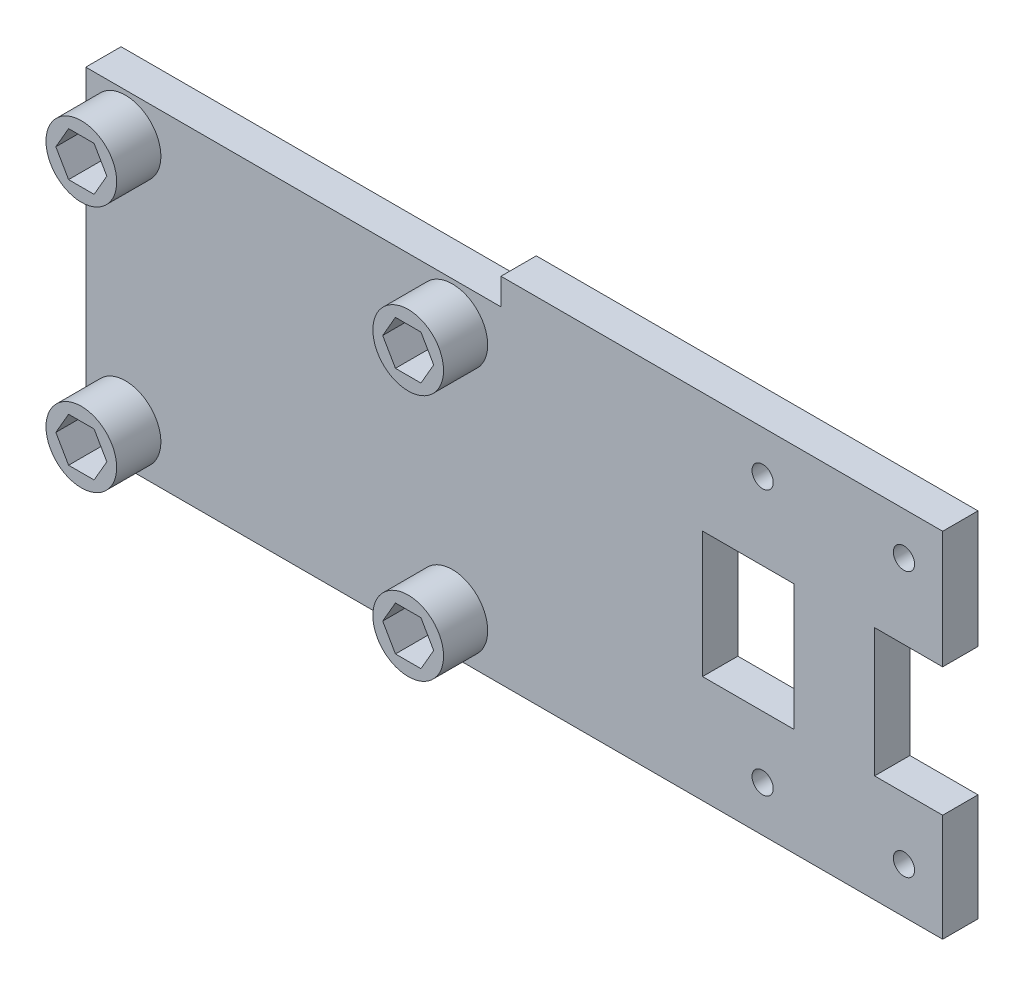
from build123d import *

# Parameters (mm, degrees)
SKETCH1_W                                        = 50
SKETCH1_H                                        = 40
BOSS_EXTRUDE1_DEPTH                              = 4
SKETCH2_W                                        = 7.705962758
SKETCH2_H                                        = 14.539090136
CUT_EXTRUDE1_DEPTH                               = 122.811546491
SKETCH3_W                                        = 10.372123492
SKETCH3_H                                        = 14.267331442
CUT_EXTRUDE2_DEPTH                               = 122.811546491
CBORE_FOR_M2_PAN_HEAD_MACHINE_SCREW1_D           = 2.4
CBORE_FOR_M2_PAN_HEAD_MACHINE_SCREW1_CBORE_D     = 5
CBORE_FOR_M2_PAN_HEAD_MACHINE_SCREW1_CBORE_DEPTH = 1.6
SKETCH6_W                                        = 47
SKETCH6_H                                        = 37
BOSS_EXTRUDE2_DEPTH                              = 4
SKETCH7_R                                        = 4
BOSS_EXTRUDE3_DEPTH                              = 5
F_2_7_2_7_DIAMETER_HOLE1_D                       = 2.7
F_2_7_2_7_DIAMETER_HOLE1_DEPTH                   = 4
F_2_7_2_7_DIAMETER_HOLE1_TIP                     = 0.811161836
CUT_EXTRUDE3_DEPTH                               = 6.5


with BuildPart() as part:
    # Sketch1 → Boss-Extrude1 (new body)
    with BuildSketch(Plane(origin=(0, 0, 34.811611197), x_dir=(-1, 0, 0), z_dir=(0, 0, -1))):
        with Locations((1.46446617, 98.834695645)):
            Rectangle(SKETCH1_W, SKETCH1_H)
    extrude(amount=-BOSS_EXTRUDE1_DEPTH)

    # Sketch2 → Cut-Extrude1 (cut, through all)
    with BuildSketch(Plane.XY.offset(38.811611197)):
        with Locations((19.682552451, 98.267628733)):
            Rectangle(SKETCH2_W, SKETCH2_H)
    extrude(amount=-CUT_EXTRUDE1_DEPTH, mode=Mode.SUBTRACT)

    # Sketch3 → Cut-Extrude2 (cut, through all)
    with BuildSketch(Plane.XY.offset(38.811611197)):
        with Locations((1.539593072, 98.131749386)):
            Rectangle(SKETCH3_W, SKETCH3_H)
    extrude(amount=-CUT_EXTRUDE2_DEPTH, mode=Mode.SUBTRACT)

    # CBORE for M2 Pan Head Machine Screw1 (through all)
    with Locations(Plane(origin=(0, 0, 34.811611197), x_dir=(-1, 0, 0), z_dir=(0, 0, -1))):
        with Locations((-3.156646479, 84.016340669), (-19.156646479, 84.016340669), (-19.156646479, 114.016340669), (-3.156646479, 114.016340669)):
            CounterBoreHole(CBORE_FOR_M2_PAN_HEAD_MACHINE_SCREW1_D / 2, CBORE_FOR_M2_PAN_HEAD_MACHINE_SCREW1_CBORE_D / 2, CBORE_FOR_M2_PAN_HEAD_MACHINE_SCREW1_CBORE_DEPTH)

    # Sketch6 → Boss-Extrude2 (add)
    with BuildSketch(Plane.XY.offset(38.811611197)):
        with Locations((-49.96446617, 97.334695645)):
            Rectangle(SKETCH6_W, SKETCH6_H)
    extrude(amount=-BOSS_EXTRUDE2_DEPTH)

    # Sketch7 → Boss-Extrude3 (add)
    with BuildSketch(Plane.XY.offset(38.811611197)):
        with Locations(Location((-68.96446617, 111.334695645, 0), (0, 0, 180))):
            Circle(SKETCH7_R)
        with Locations(Location((-31.96446617, 111.334695645, 0), (0, 0, 180))):
            Circle(SKETCH7_R)
        with Locations(Location((-68.96446617, 83.334695645, 0), (0, 0, 180))):
            Circle(SKETCH7_R)
        with Locations(Location((-31.96446617, 83.334695645, 0), (0, 0, 180))):
            Circle(SKETCH7_R)
    extrude(amount=BOSS_EXTRUDE3_DEPTH)

    # Ø2.7 (2.7) Diameter Hole1
    with Locations(Plane.XY.offset(43.811611197)):
        with Locations((-68.96446617, 111.334695645), (-31.96446617, 111.334695645), (-31.96446617, 83.334695645), (-68.96446617, 83.334695645)):
            Hole(F_2_7_2_7_DIAMETER_HOLE1_D / 2, depth=F_2_7_2_7_DIAMETER_HOLE1_DEPTH)
            with Locations((0, 0, -(F_2_7_2_7_DIAMETER_HOLE1_DEPTH + F_2_7_2_7_DIAMETER_HOLE1_TIP / 2))):  # 118° drill point
                Cone(0, F_2_7_2_7_DIAMETER_HOLE1_D / 2, F_2_7_2_7_DIAMETER_HOLE1_TIP, mode=Mode.SUBTRACT)

    # Sketch10 → Cut-Extrude3 (cut)
    with BuildSketch(Plane.XY.offset(43.811611197)):
        Polygon((-67.521090497, 113.834695645), (-70.407841843, 113.834695645), (-71.851217516, 111.334695645), (-70.407841843, 108.834695645), (-67.521090497, 108.834695645), (-66.077714824, 111.334695645), align=None)
        Polygon((-67.521090497, 85.834695645), (-70.407841843, 85.834695645), (-71.851217516, 83.334695645), (-70.407841843, 80.834695645), (-67.521090497, 80.834695645), (-66.077714824, 83.334695645), align=None)
        Polygon((-30.521090497, 113.834695645), (-33.407841843, 113.834695645), (-34.851217516, 111.334695645), (-33.407841843, 108.834695645), (-30.521090497, 108.834695645), (-29.077714824, 111.334695645), align=None)
        Polygon((-30.521090497, 85.834695645), (-33.407841843, 85.834695645), (-34.851217516, 83.334695645), (-33.407841843, 80.834695645), (-30.521090497, 80.834695645), (-29.077714824, 83.334695645), align=None)
    extrude(amount=-CUT_EXTRUDE3_DEPTH, mode=Mode.SUBTRACT)


solid = part.part
